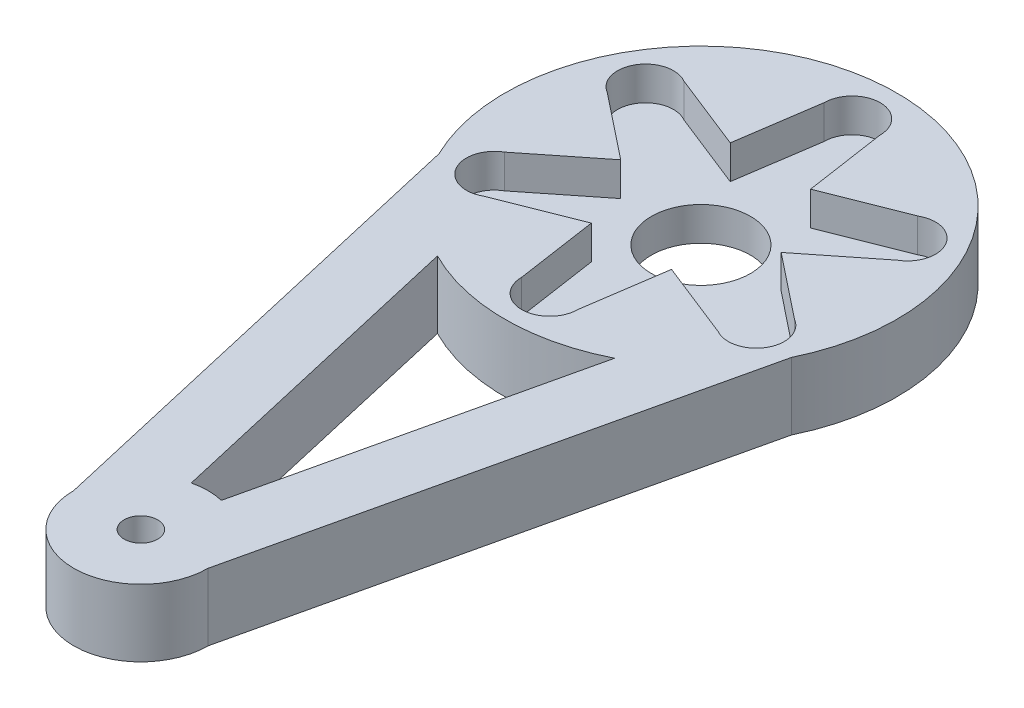
from build123d import *

# Parameters (mm, degrees)
SKETCH1_R           = 17.5
BOSS_EXTRUDE3_DEPTH = 6
SKETCH1_11_R        = 4.425
BOSS_EXTRUDE5_DEPTH = 3
SKETCH2_R           = 1.5
BOSS_EXTRUDE6_DEPTH = 6


with BuildPart() as part:
    # Sketch1 → Boss-Extrude3 (new body)
    with BuildSketch(Plane(origin=(0, 0, 0), x_dir=(1, 0, 0), z_dir=(0, 1, 0))):
        Circle(SKETCH1_R)
        with BuildLine():
            ThreePointArc((-2.5, 13.5), (-1.767766953, 15.267766953), (0, 16))
            ThreePointArc((0, 16), (1.767766953, 15.267766953), (2.5, 13.5))
            Line((2.5, 13.5), (3.581091494, 6.202632414))
            Line((3.581091494, 6.202632414), (10.441342951, 8.915063509))
            ThreePointArc((10.441342951, 8.915063509), (12.338390564, 9.164814566), (13.856406461, 8))
            ThreePointArc((13.856406461, 8), (14.106157517, 7.397047613), (14.191342951, 6.75))
            ThreePointArc((14.191342951, 6.75), (13.856406461, 5.5), (12.941342951, 4.584936491))
            Line((12.941342951, 4.584936491), (7.162182988, 0))
            Line((7.162182988, 0), (12.941342951, -4.584936491))
            ThreePointArc((12.941342951, -4.584936491), (13.856406461, -5.5), (14.191342951, -6.75))
            ThreePointArc((14.191342951, -6.75), (14.106157517, -7.397047613), (13.856406461, -8))
            ThreePointArc((13.856406461, -8), (12.338390564, -9.164814566), (10.441342951, -8.915063509))
            Line((10.441342951, -8.915063509), (3.581091494, -6.202632414))
            Line((3.581091494, -6.202632414), (2.5, -13.5))
            ThreePointArc((2.5, -13.5), (1.767766953, -15.267766953), (0, -16))
            ThreePointArc((0, -16), (-1.767766953, -15.267766953), (-2.5, -13.5))
            Line((-2.5, -13.5), (-3.581091494, -6.202632414))
            Line((-3.581091494, -6.202632414), (-10.441342951, -8.915063509))
            ThreePointArc((-10.441342951, -8.915063509), (-12.338390564, -9.164814566), (-13.856406461, -8))
            ThreePointArc((-13.856406461, -8), (-14.106157517, -6.102952387), (-12.941342951, -4.584936491))
            Line((-12.941342951, -4.584936491), (-7.162182988, 0))
            Line((-7.162182988, 0), (-12.941342951, 4.584936491))
            ThreePointArc((-12.941342951, 4.584936491), (-14.106157517, 6.102952387), (-13.856406461, 8))
            ThreePointArc((-13.856406461, 8), (-12.338390564, 9.164814566), (-10.441342951, 8.915063509))
            Line((-10.441342951, 8.915063509), (-3.581091494, 6.202632414))
            Line((-3.581091494, 6.202632414), (-2.5, 13.5))
        make_face(mode=Mode.SUBTRACT)
    extrude(amount=BOSS_EXTRUDE3_DEPTH)

    # Sketch1<11> → Boss-Extrude5 (add)
    with BuildSketch(Plane(origin=(0, 0, 0), x_dir=(1, 0, 0), z_dir=(0, 1, 0))):
        with BuildLine():
            Line((-2.5, 13.5), (-3.581091494, 6.202632414))
            Line((-3.581091494, 6.202632414), (-10.441342951, 8.915063509))
            ThreePointArc((-10.441342951, 8.915063509), (-13.856406461, 8), (-12.941342951, 4.584936491))
            Line((-12.941342951, 4.584936491), (-7.162182988, 0))
            Line((-7.162182988, 0), (-12.941342951, -4.584936491))
            ThreePointArc((-12.941342951, -4.584936491), (-13.856406461, -8), (-10.441342951, -8.915063509))
            Line((-10.441342951, -8.915063509), (-3.581091494, -6.202632414))
            Line((-3.581091494, -6.202632414), (-2.5, -13.5))
            ThreePointArc((-2.5, -13.5), (0, -16), (2.5, -13.5))
            Line((2.5, -13.5), (3.581091494, -6.202632414))
            Line((3.581091494, -6.202632414), (10.441342951, -8.915063509))
            ThreePointArc((10.441342951, -8.915063509), (13.856406461, -8), (12.941342951, -4.584936491))
            Line((12.941342951, -4.584936491), (7.162182988, 0))
            Line((7.162182988, 0), (12.941342951, 4.584936491))
            ThreePointArc((12.941342951, 4.584936491), (13.856406461, 8), (10.441342951, 8.915063509))
            Line((10.441342951, 8.915063509), (3.581091494, 6.202632414))
            Line((3.581091494, 6.202632414), (2.5, 13.5))
            ThreePointArc((2.5, 13.5), (0, 16), (-2.5, 13.5))
        make_face()
        Circle(SKETCH1_11_R, mode=Mode.SUBTRACT)
    extrude(amount=BOSS_EXTRUDE5_DEPTH)

    # Sketch2 → Boss-Extrude6 (add)
    with BuildSketch(Plane.XZ):
        with BuildLine():
            ThreePointArc((-1.344886158, 44.15266888), (0, 44), (1.344886158, 44.15266888))
            Line((1.344886158, 44.15266888), (7.909578705, 15.610527368))
            ThreePointArc((7.909578705, 15.610527368), (12.478135775, 12.269724022), (15.741523412, 7.645550385))
            Line((15.741523412, 7.645550385), (6, 50))
            ThreePointArc((6, 50), (0, 56), (-6, 50))
            Line((-6, 50), (-15.741523412, 7.645550385))
            ThreePointArc((-15.741523412, 7.645550385), (-12.478135775, 12.269724022), (-7.909578705, 15.610527368))
            Line((-7.909578705, 15.610527368), (-1.344886158, 44.15266888))
        make_face()
        with Locations((0, 50)):
            Circle(SKETCH2_R, mode=Mode.SUBTRACT)
    extrude(amount=-BOSS_EXTRUDE6_DEPTH)


solid = part.part
